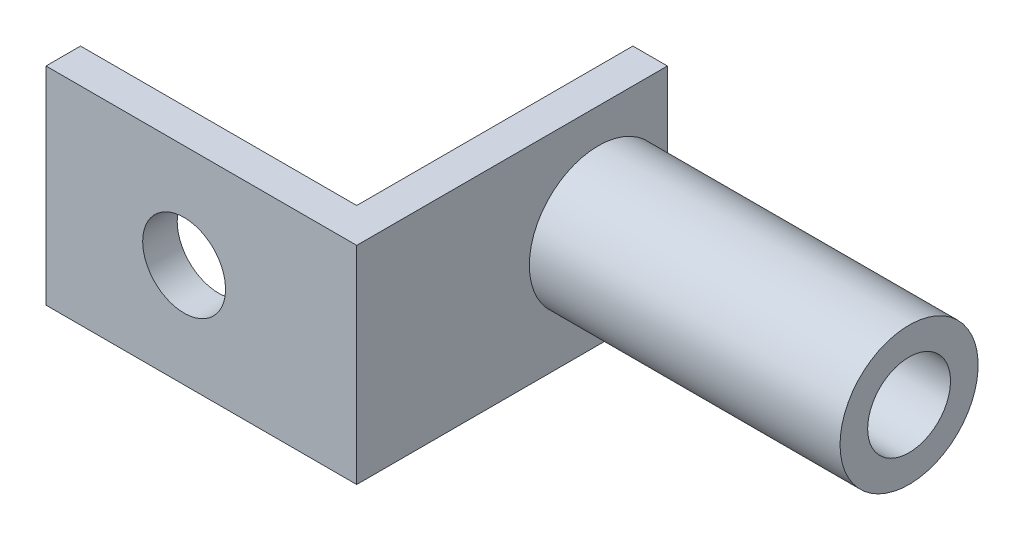
from build123d import *

# Parameters (mm, degrees)
BOSS_EXTRUDE2_DEPTH = 15
SKETCH4_R           = 3
CUT_EXTRUDE2_DEPTH  = 34.634060118
SKETCH7_R           = 5
SKETCH7_R_2         = 3
BOSS_EXTRUDE5_DEPTH = 25
SKETCH8_R           = 3
CUT_EXTRUDE3_DEPTH  = 36.178118199


with BuildPart() as part:
    # Sketch3 → Boss-Extrude2 (new body)
    with BuildSketch(Plane(origin=(0, 0, 0), x_dir=(1, 0, 0), z_dir=(0, 1, 0))):
        Polygon((0, 0), (22.5, 0), (22.5, 22.5), (20, 22.5), (20, 2.5), (0, 2.5), align=None)
    extrude(amount=BOSS_EXTRUDE2_DEPTH)

    # Sketch4 → Cut-Extrude2 (cut, through all)
    with BuildSketch(Plane(origin=(0, 0, -2.5), x_dir=(-1, 0, 0), z_dir=(0, 0, -1))):
        with Locations((-10, 7.5)):
            Circle(SKETCH4_R)
    extrude(amount=-CUT_EXTRUDE2_DEPTH, mode=Mode.SUBTRACT)

    # Sketch7 → Boss-Extrude5 (add)
    with BuildSketch(Plane.ZY.offset(-20)):
        with Locations((-17.5, 7.5)):
            Circle(SKETCH7_R)
        with Locations((-17.5, 7.5)):
            Circle(SKETCH7_R_2, mode=Mode.SUBTRACT)
    extrude(amount=-BOSS_EXTRUDE5_DEPTH)

    # Sketch8 → Cut-Extrude3 (cut, through all)
    with BuildSketch(Plane(origin=(22.5, 0, 0), x_dir=(0, 0, -1), z_dir=(1, 0, 0))):
        with Locations(Location((17.5, 7.5, 0), (0, 0, 180))):
            Circle(SKETCH8_R)
    extrude(amount=-CUT_EXTRUDE3_DEPTH, mode=Mode.SUBTRACT)


solid = part.part
